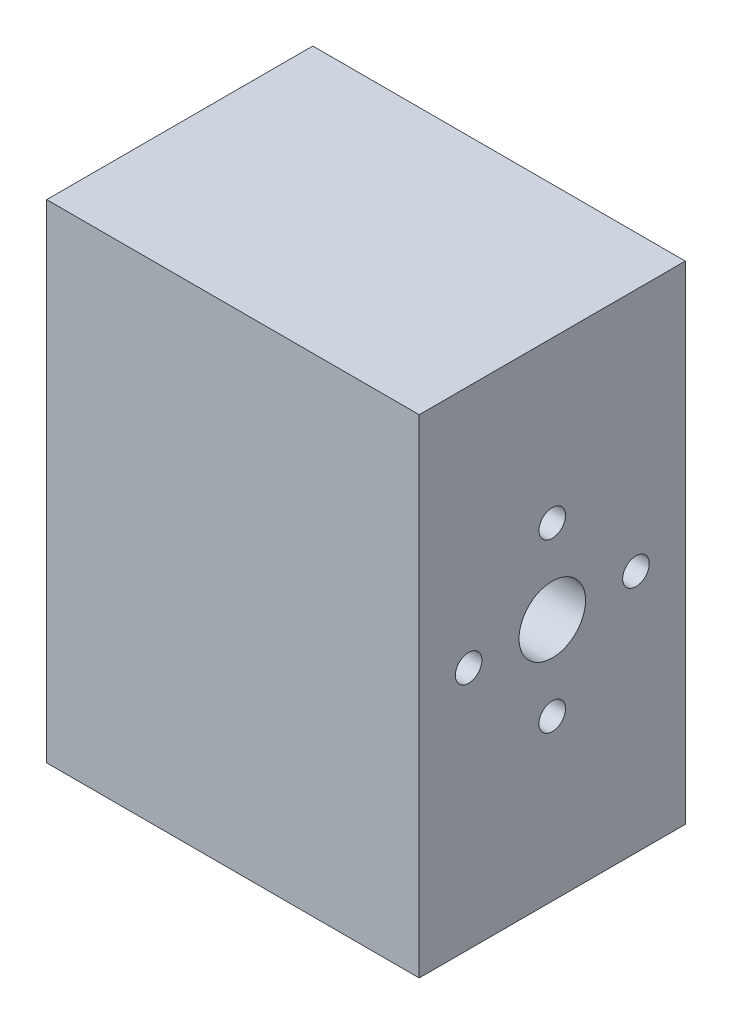
from build123d import *

# Parameters (mm, degrees)
SKETCH_1_W          = 42
SKETCH_1_H          = 55
EXTRUDE_1_DEPTH     = 30
SKETCH_2_R          = 3.75
SKETCH_2_R_2        = 1.5
CUT_EXTRUDE_1_DEPTH = 76.425459893


with BuildPart() as part:
    # Эскиз1 → Бобышка-Вытянуть1 (new body)
    with BuildSketch(Plane.XY):
        with Locations((21, 27.5)):
            Rectangle(SKETCH_1_W, SKETCH_1_H)
    extrude(amount=EXTRUDE_1_DEPTH)

    # Эскиз2 → Вырез-Вытянуть1 (cut, through all)
    with BuildSketch(Plane(origin=(42, 0, 0), x_dir=(0, 0, -1), z_dir=(1, 0, 0))):
        with Locations((-15, 27.5)):
            Circle(SKETCH_2_R)
        with Locations((-15, 36.934474839)):
            Circle(SKETCH_2_R_2)
        with Locations((-5.565525161, 27.5)):
            Circle(SKETCH_2_R_2)
        with Locations((-15, 18.065525161)):
            Circle(SKETCH_2_R_2)
        with Locations((-24.434474839, 27.5)):
            Circle(SKETCH_2_R_2)
    extrude(amount=-CUT_EXTRUDE_1_DEPTH, mode=Mode.SUBTRACT)


solid = part.part
